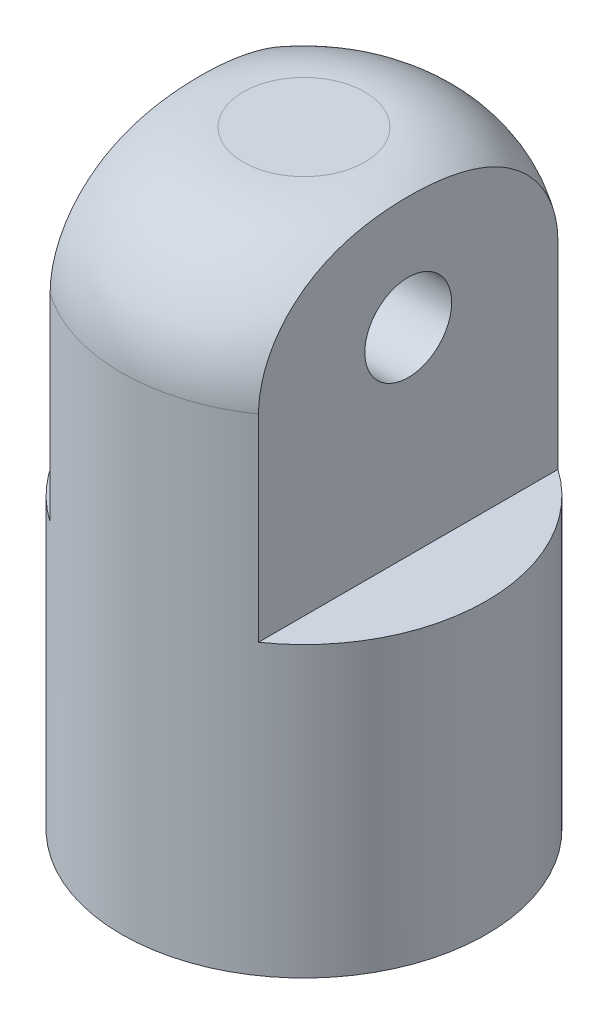
from build123d import *

# Parameters (mm, degrees)
SKETCH_1_R          = 10.5
EXTRUDE_1_DEPTH     = 35
FILLET_1_R          = 7
SKETCH_2_W          = 7.958584752
SKETCH_2_H          = 21.543065623
CUT_EXTRUDE_2_DEPTH = 20
SKETCH_3_R          = 2.5
CUT_EXTRUDE_3_DEPTH = 41.093640507


with BuildPart() as part:
    # Эскиз1 → Вытянуть1 (new body)
    with BuildSketch(Plane(origin=(0, 0, 0), x_dir=(1, 0, 0), z_dir=(0, 1, 0))):
        with Locations(Location((0, 0, 0), (0, 0, 270))):
            Circle(SKETCH_1_R)
    extrude(amount=EXTRUDE_1_DEPTH)

    # Скругление1
    fillet_1_edges = [part.edges().sort_by_distance(p)[0] for p in [
        (0, 35, -10.5),
    ]]
    fillet(fillet_1_edges, radius=FILLET_1_R)

    # Эскиз2 → Вытянуть2 (cut, symmetric)
    with BuildSketch(Plane.XY):
        with Locations((9.979292376, 27.395051325)):
            Rectangle(SKETCH_2_W, SKETCH_2_H)
        with Locations((-9.979292376, 27.395051325)):
            Rectangle(SKETCH_2_W, SKETCH_2_H)
    extrude(amount=CUT_EXTRUDE_2_DEPTH, both=True, mode=Mode.SUBTRACT)

    # Эскиз3 → Вытянуть3 (cut, through all)
    with BuildSketch(Plane(origin=(6, 0, 0), x_dir=(0, 0, -1), z_dir=(1, 0, 0))):
        with Locations(Location((0, 28.011489149, 0), (0, 0, 90))):
            Circle(SKETCH_3_R)
    extrude(amount=-CUT_EXTRUDE_3_DEPTH, mode=Mode.SUBTRACT)


solid = part.part
